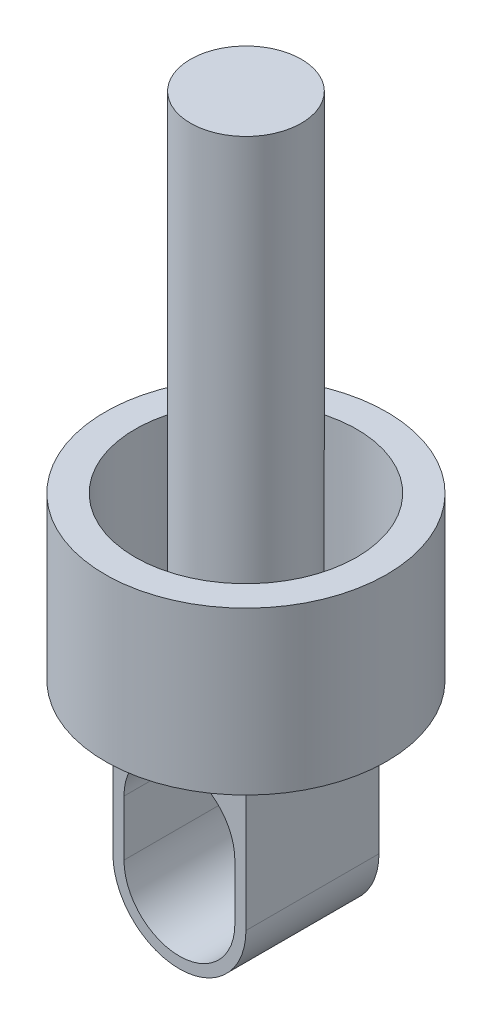
from build123d import *

# Parameters (mm, degrees)
SKETCH2_W               = 25
SKETCH2_H               = 230
SKETCH13_R              = 63.5
BOSS_EXTRUDE5_DEPTH     = 73
SKETCH16_R              = 50
SKETCH16_R_2            = 25
CUT_EXTRUDE7_DEPTH      = 230
SKETCH17_W              = 60
SKETCH17_H              = 60
BOSS_EXTRUDE7_DEPTH     = 97.8
CUT_EXTRUDE8_DEPTH      = 97.8
CUT_EXTRUDE8_DEPTH_BACK = 97.8
FILLET15_RADIUS         = 30
FILLET15_LENGTH         = 60


with BuildPart() as part:
    # Sketch2 → Revolve2 (revolve)
    with BuildSketch(Plane.XY, mode=Mode.PRIVATE) as revolve2_sk:
        with Locations((12.5, 115)):
            Rectangle(SKETCH2_W, SKETCH2_H)
    revolve(revolve2_sk.sketch.rotate(Axis((0, 230, 0), (0, -1, 0)), 180), axis=Axis((0, 230, 0), (0, -1, 0)))

    # Sketch13 → Boss-Extrude5 (add)
    with BuildSketch(Plane.XZ):
        Circle(SKETCH13_R)
    extrude(amount=-BOSS_EXTRUDE5_DEPTH)

    # Sketch16 → Cut-Extrude7 (cut)
    with BuildSketch(Plane(origin=(0, 230, 0), x_dir=(1, 0, 0), z_dir=(0, 1, 0))):
        with Locations(Location((0, 0, 0), (0, 0, 270))):
            Circle(SKETCH16_R)
        with Locations(Location((0, 0, 0), (0, 0, 180))):
            Circle(SKETCH16_R_2, mode=Mode.SUBTRACT)
    extrude(amount=-CUT_EXTRUDE7_DEPTH, mode=Mode.SUBTRACT)


with BuildPart() as cut_extrude7_piece_1:
    # of the separate pieces the step leaves, piece 1, a body of its own (cut_extrude7_pieces)
    add(part.part.solids().sort_by_distance((-25, 0, 0))[0])

    # Sketch17 → Boss-Extrude7 (add)
    with BuildSketch(Plane.XZ):
        Rectangle(SKETCH17_W, SKETCH17_H)
    extrude(amount=BOSS_EXTRUDE7_DEPTH)

    # Sketch18 → Cut-Extrude8 (cut, two sides: drawn at the far end of the back side and taken through both)
    with BuildSketch(Plane.XY.offset(-CUT_EXTRUDE8_DEPTH_BACK)):
        with BuildLine():
            Line((-25, -42.8), (-25, -67.8))
            ThreePointArc((-25, -67.8), (0, -92.8), (25, -67.8))
            Line((25, -67.8), (25, -42.8))
            ThreePointArc((25, -42.8), (0, -17.8), (-25, -42.8))
        make_face()
    extrude(amount=CUT_EXTRUDE8_DEPTH + CUT_EXTRUDE8_DEPTH_BACK, mode=Mode.SUBTRACT)

    # Fillet15: full round fillet: the end face becomes a half cylinder, R = half its width
    fillet15_face = Plane((0, -97.8, 0), x_dir=(0, 0, 1), z_dir=(0, -1, 0))  # on the end face: x along it, z out of the body
    fillet15_slab = fillet15_face.offset(-FILLET15_RADIUS / 2) * Box(FILLET15_LENGTH, 2 * FILLET15_RADIUS, FILLET15_RADIUS, mode=Mode.PRIVATE)  # the body's end, R deep
    fillet15_round = Plane((0, -67.8, 0), x_dir=(0, -1, 0), z_dir=(0, 0, 1)) * Cylinder(FILLET15_RADIUS, FILLET15_LENGTH, mode=Mode.PRIVATE)  # its axis R under the face
    add(fillet15_slab - fillet15_round, mode=Mode.SUBTRACT)


with BuildPart() as cut_extrude7_piece_2:
    # of the separate pieces the step leaves, piece 2, a body of its own (cut_extrude7_pieces)
    add(part.part.solids().sort_by_distance((63.5, 0, 0))[0])


solid = Compound([cut_extrude7_piece_1.part, cut_extrude7_piece_2.part])
